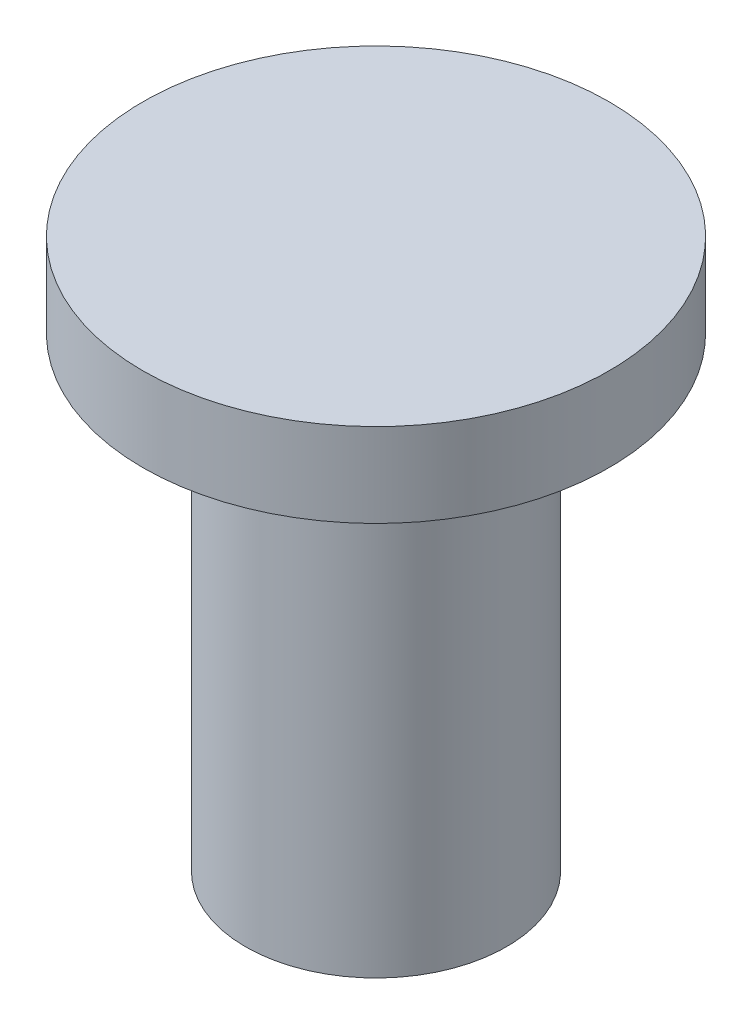
from build123d import *

# Parameters (mm, degrees)
SKETCH1_R           = 1.4
BOSS_EXTRUDE1_DEPTH = 2.5
SKETCH2_R           = 2.5
BOSS_EXTRUDE2_DEPTH = 0.9


with BuildPart() as part:
    # Sketch1 → Boss-Extrude1 (new, symmetric)
    with BuildSketch(Plane(origin=(0, 0, 0), x_dir=(1, 0, 0), z_dir=(0, 1, 0))):
        with Locations(Location((0, 0, 0), (0, 0, 270))):
            Circle(SKETCH1_R)
    extrude(amount=BOSS_EXTRUDE1_DEPTH, both=True)

    # Sketch2 → Boss-Extrude2 (add)
    with BuildSketch(Plane(origin=(0, 2.5, 0), x_dir=(1, 0, 0), z_dir=(0, 1, 0))):
        with Locations(Location((0, 0, 0), (0, 0, 270))):
            Circle(SKETCH2_R)
    extrude(amount=BOSS_EXTRUDE2_DEPTH)


solid = part.part
